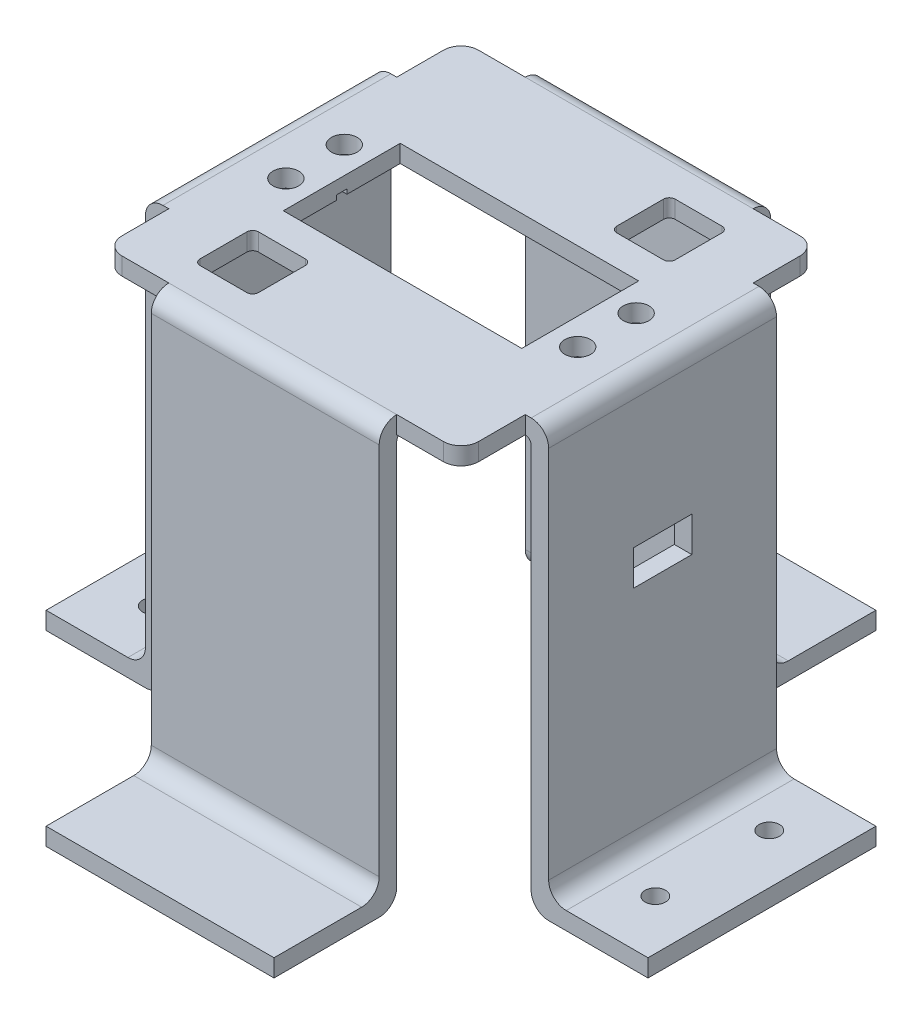
from build123d import *

# Parameters (mm, degrees)
SALIENTE_EXTRUIR1_DEPTH = 19.5
CROQUIS1_4_W            = 61
CROQUIS1_4_H            = 3
SALIENTE_EXTRUIR2_DEPTH = 30.5
CORTAR_EXTRUIR1_REACH   = 96.401
CROQUIS2_R              = 2.2
CROQUIS2_W              = 40.8
CROQUIS2_H              = 20
CROQUIS2_W_2            = 10
CROQUIS2_H_2            = 10
CROQUIS3_W              = 7
CROQUIS3_H              = 1.8
CORTAR_EXTRUIR2_DEPTH   = 0.8
CORTAR_EXTRUIR3_REACH   = 96.401
CROQUIS4_R              = 1.75
REDONDEO1_R             = 3
REDONDEO2_R             = 1
SALIENTE_EXTRUIR3_DEPTH = 19.5
REDONDEO3_R             = 3
REDONDEO4_R             = 1
CROQUIS10_W             = 10
CROQUIS10_H             = 6
CORTAR_EXTRUIR4_DEPTH   = 122.94363452


with BuildPart() as part:
    # Croquis1 → Saliente-Extruir1 (new, symmetric)
    with BuildSketch(Plane.XY):
        Polygon((-51.5, 0), (-31.5, 0), (-31.5, 70), (31.5, 70), (31.5, 0), (51.5, 0), (51.5, 3), (34.5, 3), (34.5, 73), (-34.5, 73), (-34.5, 3), (-51.5, 3), align=None)
    extrude(amount=SALIENTE_EXTRUIR1_DEPTH, both=True)

    # Croquis1<4> → Saliente-Extruir2 (add, symmetric)
    with BuildSketch(Plane.XY):
        with Locations((0, 71.5)):
            Rectangle(CROQUIS1_4_W, CROQUIS1_4_H)
    extrude(amount=SALIENTE_EXTRUIR2_DEPTH, both=True)

    # Croquis2 → Cortar-Extruir1 (cut, up to next)
    with BuildSketch(Plane(origin=(0, 73, 0), x_dir=(1, 0, 0), z_dir=(0, 1, 0)), mode=Mode.PRIVATE) as cortar_extruir1_sk1:
        with Locations((24.97, 5)):
            Circle(CROQUIS2_R)
    cortar_extruir1_tool1 = extrude(cortar_extruir1_sk1.sketch, amount=-CORTAR_EXTRUIR1_REACH, mode=Mode.PRIVATE) & part.part
    # Croquis2 → Cortar-Extruir1 (cut, up to next)
    with BuildSketch(Plane(origin=(0, 73, 0), x_dir=(1, 0, 0), z_dir=(0, 1, 0)), mode=Mode.PRIVATE) as cortar_extruir1_sk2:
        with Locations((24.97, -5)):
            Circle(CROQUIS2_R)
    cortar_extruir1_tool2 = extrude(cortar_extruir1_sk2.sketch, amount=-CORTAR_EXTRUIR1_REACH, mode=Mode.PRIVATE) & part.part
    # Croquis2 → Cortar-Extruir1 (cut, up to next)
    with BuildSketch(Plane(origin=(0, 73, 0), x_dir=(1, 0, 0), z_dir=(0, 1, 0)), mode=Mode.PRIVATE) as cortar_extruir1_sk3:
        with Locations((-24.97, 5)):
            Circle(CROQUIS2_R)
    cortar_extruir1_tool3 = extrude(cortar_extruir1_sk3.sketch, amount=-CORTAR_EXTRUIR1_REACH, mode=Mode.PRIVATE) & part.part
    # Croquis2 → Cortar-Extruir1 (cut, up to next)
    with BuildSketch(Plane(origin=(0, 73, 0), x_dir=(1, 0, 0), z_dir=(0, 1, 0)), mode=Mode.PRIVATE) as cortar_extruir1_sk4:
        with Locations((-24.97, -5)):
            Circle(CROQUIS2_R)
    cortar_extruir1_tool4 = extrude(cortar_extruir1_sk4.sketch, amount=-CORTAR_EXTRUIR1_REACH, mode=Mode.PRIVATE) & part.part
    # Croquis2 → Cortar-Extruir1 (cut, up to next)
    with BuildSketch(Plane(origin=(0, 73, 0), x_dir=(1, 0, 0), z_dir=(0, 1, 0)), mode=Mode.PRIVATE) as cortar_extruir1_sk5:
        Rectangle(CROQUIS2_W, CROQUIS2_H)
    cortar_extruir1_tool5 = extrude(cortar_extruir1_sk5.sketch, amount=-CORTAR_EXTRUIR1_REACH, mode=Mode.PRIVATE) & part.part
    # Croquis2 → Cortar-Extruir1 (cut, up to next)
    with BuildSketch(Plane(origin=(0, 73, 0), x_dir=(1, 0, 0), z_dir=(0, 1, 0)), mode=Mode.PRIVATE) as cortar_extruir1_sk6:
        with Locations((15.4, 20.25)):
            Rectangle(CROQUIS2_W_2, CROQUIS2_H_2)
    cortar_extruir1_tool6 = extrude(cortar_extruir1_sk6.sketch, amount=-CORTAR_EXTRUIR1_REACH, mode=Mode.PRIVATE) & part.part
    # Croquis2 → Cortar-Extruir1 (cut, up to next)
    with BuildSketch(Plane(origin=(0, 73, 0), x_dir=(1, 0, 0), z_dir=(0, 1, 0)), mode=Mode.PRIVATE) as cortar_extruir1_sk7:
        with Locations((-15.4, -20.25)):
            Rectangle(CROQUIS2_W_2, CROQUIS2_H_2)
    cortar_extruir1_tool7 = extrude(cortar_extruir1_sk7.sketch, amount=-CORTAR_EXTRUIR1_REACH, mode=Mode.PRIVATE) & part.part
    add(cortar_extruir1_tool1.solids().sort_by_distance((24.97, 73, -5))[0], mode=Mode.SUBTRACT)
    add(cortar_extruir1_tool2.solids().sort_by_distance((24.97, 73, 5))[0], mode=Mode.SUBTRACT)
    add(cortar_extruir1_tool3.solids().sort_by_distance((-24.97, 73, -5))[0], mode=Mode.SUBTRACT)
    add(cortar_extruir1_tool4.solids().sort_by_distance((-24.97, 73, 5))[0], mode=Mode.SUBTRACT)
    add(cortar_extruir1_tool5.solids().sort_by_distance((0, 73, 0))[0], mode=Mode.SUBTRACT)
    add(cortar_extruir1_tool6.solids().sort_by_distance((15.4, 73, -20.25))[0], mode=Mode.SUBTRACT)
    add(cortar_extruir1_tool7.solids().sort_by_distance((-15.4, 73, 20.25))[0], mode=Mode.SUBTRACT)

    # Croquis3 → Cortar-Extruir2 (cut)
    with BuildSketch(Plane.XZ.offset(-70)):
        with Locations((23.9, 0)):
            Rectangle(CROQUIS3_W, CROQUIS3_H)
        with Locations((-23.9, 0)):
            Rectangle(CROQUIS3_W, CROQUIS3_H)
    extrude(amount=-CORTAR_EXTRUIR2_DEPTH, mode=Mode.SUBTRACT)

    # Croquis4 → Cortar-Extruir3 (cut, up to next)
    with BuildSketch(Plane.XZ, mode=Mode.PRIVATE) as cortar_extruir3_sk1:
        with Locations((43, 9.75)):
            Circle(CROQUIS4_R)
    cortar_extruir3_tool1 = extrude(cortar_extruir3_sk1.sketch, amount=-CORTAR_EXTRUIR3_REACH, mode=Mode.PRIVATE) & part.part
    # Croquis4 → Cortar-Extruir3 (cut, up to next)
    with BuildSketch(Plane.XZ, mode=Mode.PRIVATE) as cortar_extruir3_sk2:
        with Locations((43, -9.75)):
            Circle(CROQUIS4_R)
    cortar_extruir3_tool2 = extrude(cortar_extruir3_sk2.sketch, amount=-CORTAR_EXTRUIR3_REACH, mode=Mode.PRIVATE) & part.part
    # Croquis4 → Cortar-Extruir3 (cut, up to next)
    with BuildSketch(Plane.XZ, mode=Mode.PRIVATE) as cortar_extruir3_sk3:
        with Locations((-43, -9.75)):
            Circle(CROQUIS4_R)
    cortar_extruir3_tool3 = extrude(cortar_extruir3_sk3.sketch, amount=-CORTAR_EXTRUIR3_REACH, mode=Mode.PRIVATE) & part.part
    # Croquis4 → Cortar-Extruir3 (cut, up to next)
    with BuildSketch(Plane.XZ, mode=Mode.PRIVATE) as cortar_extruir3_sk4:
        with Locations((-43, 9.75)):
            Circle(CROQUIS4_R)
    cortar_extruir3_tool4 = extrude(cortar_extruir3_sk4.sketch, amount=-CORTAR_EXTRUIR3_REACH, mode=Mode.PRIVATE) & part.part
    add(cortar_extruir3_tool1.solids().sort_by_distance((43, 0, 9.75))[0], mode=Mode.SUBTRACT)
    add(cortar_extruir3_tool2.solids().sort_by_distance((43, 0, -9.75))[0], mode=Mode.SUBTRACT)
    add(cortar_extruir3_tool3.solids().sort_by_distance((-43, 0, -9.75))[0], mode=Mode.SUBTRACT)
    add(cortar_extruir3_tool4.solids().sort_by_distance((-43, 0, 9.75))[0], mode=Mode.SUBTRACT)

    # Redondeo1
    redondeo1_edges = [part.edges().sort_by_distance(p)[0] for p in [
        (31.5, 0, 0),
        (-31.5, 0, 0),
        (-34.5, 73, 0),
        (34.5, 73, 0),
        (-34.5, 3, 0),
        (34.5, 3, 0),
        (-30.5, 71.5, -30.5),
        (30.5, 71.5, -30.5),
        (-30.5, 71.5, 30.5),
        (30.5, 71.5, 30.5),
    ]]
    fillet(redondeo1_edges, radius=REDONDEO1_R)

    # Redondeo2
    redondeo2_edges = [part.edges().sort_by_distance(p)[0] for p in [
        (-31.5, 70, 0),
        (31.5, 70, 0),
        (-20.4, 71.5, 25.25),
        (-20.4, 71.5, 15.25),
        (-10.4, 71.5, 15.25),
        (-10.4, 71.5, 25.25),
        (20.4, 71.5, -15.25),
        (10.4, 71.5, -15.25),
        (10.4, 71.5, -25.25),
        (20.4, 71.5, -25.25),
    ]]
    fillet(redondeo2_edges, radius=REDONDEO2_R)

    # Croquis8 → Saliente-Extruir3 (add, symmetric)
    with BuildSketch(Plane(origin=(0, 0, 0), x_dir=(0, 0, -1), z_dir=(1, 0, 0))):
        Polygon((-30.5, 73), (-33.5, 73), (-33.5, 3), (-51.5, 3), (-51.5, 0), (-30.5, 0), (-30.5, 70), align=None)
        Polygon((51.5, 3), (51.5, 0), (30.5, 0), (30.5, 70), (30.5, 73), (33.5, 73), (33.5, 3), align=None)
    extrude(amount=SALIENTE_EXTRUIR3_DEPTH, both=True)

    # Redondeo3
    redondeo3_edges = [part.edges().sort_by_distance(p)[0] for p in [
        (0, 73, -33.5),
        (0, 3, -33.5),
        (0, 0, -30.5),
        (0, 0, 30.5),
        (0, 3, 33.5),
        (0, 73, 33.5),
    ]]
    fillet(redondeo3_edges, radius=REDONDEO3_R)

    # Redondeo4
    redondeo4_edges = [part.edges().sort_by_distance(p)[0] for p in [
        (0, 70, -30.5),
        (0, 70, 30.5),
    ]]
    fillet(redondeo4_edges, radius=REDONDEO4_R)

    # Croquis10 → Cortar-Extruir4 (cut, through all)
    with BuildSketch(Plane(origin=(-31.5, 0, 0), x_dir=(0, 0, -1), z_dir=(1, 0, 0))):
        with Locations((0, 45)):
            Rectangle(CROQUIS10_W, CROQUIS10_H)
    extrude(amount=CORTAR_EXTRUIR4_DEPTH, mode=Mode.SUBTRACT)


solid = part.part
